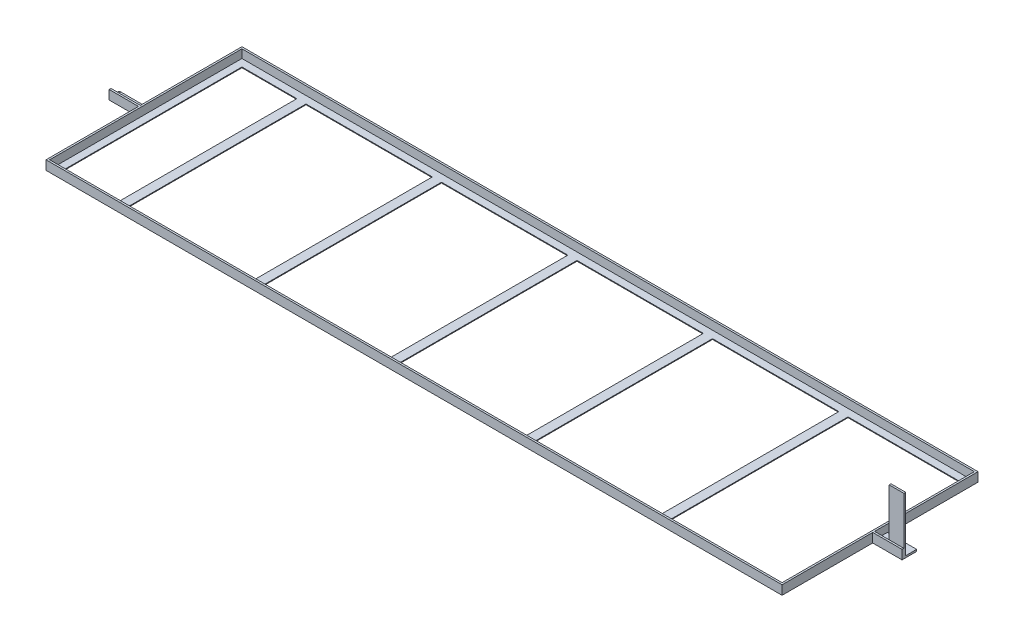
from build123d import *

# Parameters (mm, degrees)
SKETCH1_W           = 150
SKETCH1_H           = 485
SKETCH1_W_2         = 345
SKETCH1_W_3         = 305
BOSS_EXTRUDE1_DEPTH = 2
SKETCH2_W           = 2010
SKETCH2_H           = 535
SKETCH2_W_2         = 2000
SKETCH2_H_2         = 525
BOSS_EXTRUDE2_DEPTH = 25
BOSS_EXTRUDE3_DEPTH = 80
SKETCH4_W           = 40
SKETCH4_H           = 150
BOSS_EXTRUDE4_DEPTH = 5
BOSS_EXTRUDE5_DEPTH = 80
SKETCH8_R           = 2
BOSS_EXTRUDE7_DEPTH = 20


with BuildPart() as part:
    # Sketch1 → Boss-Extrude1 (new body)
    with BuildSketch(Plane(origin=(0, 0, 0), x_dir=(1, 0, 0), z_dir=(0, 1, 0))):
        Polygon((1000, -262.5), (1000, 242.5), (1000, 262.5), (-1000, 262.5), (-1000, -262.5), align=None)
        with Locations((-905, 0)):
            Rectangle(SKETCH1_W, SKETCH1_H, mode=Mode.SUBTRACT)
        with Locations((-632.5, 0)):
            Rectangle(SKETCH1_W_2, SKETCH1_H, mode=Mode.SUBTRACT)
        with Locations((-262.5, 0)):
            Rectangle(SKETCH1_W_2, SKETCH1_H, mode=Mode.SUBTRACT)
        with Locations((107.5, 0)):
            Rectangle(SKETCH1_W_2, SKETCH1_H, mode=Mode.SUBTRACT)
        with Locations((827.5, 0)):
            Rectangle(SKETCH1_W_3, SKETCH1_H, mode=Mode.SUBTRACT)
        with Locations((477.5, 0)):
            Rectangle(SKETCH1_W_2, SKETCH1_H, mode=Mode.SUBTRACT)
    extrude(amount=BOSS_EXTRUDE1_DEPTH)

    # Sketch2 → Boss-Extrude2 (add)
    with BuildSketch(Plane(origin=(0, 0, 0), x_dir=(1, 0, 0), z_dir=(0, 1, 0))):
        Rectangle(SKETCH2_W, SKETCH2_H)
        Rectangle(SKETCH2_W_2, SKETCH2_H_2, mode=Mode.SUBTRACT)
    extrude(amount=BOSS_EXTRUDE2_DEPTH)

    # Sketch3 → Boss-Extrude3 (add)
    with BuildSketch(Plane(origin=(1005, 0, 0), x_dir=(0, 0, -1), z_dir=(1, 0, 0))):
        Polygon((-20, 25), (-20, 0), (20, 0), (20, 5), (-15, 5), (-15, 25), align=None)
    extrude(amount=BOSS_EXTRUDE3_DEPTH)

    # Sketch4 → Boss-Extrude4 (add)
    with BuildSketch(Plane(origin=(0, 0, 15), x_dir=(-1, 0, 0), z_dir=(0, 0, -1))):
        with Locations((-1065, 80)):
            Rectangle(SKETCH4_W, SKETCH4_H)
    extrude(amount=BOSS_EXTRUDE4_DEPTH)

    # Sketch5 → Boss-Extrude5 (add)
    with BuildSketch(Plane.ZY.offset(1005)):
        Polygon((15, 25), (15, 0), (-15, 0), (-15, 5), (10, 5), (10, 25), align=None)
    extrude(amount=BOSS_EXTRUDE5_DEPTH)

    # Sketch8 → Boss-Extrude7 (add)
    with BuildSketch(Plane.XY.offset(15)):
        with Locations((-1077, 12.5)):
            Circle(SKETCH8_R)
    extrude(amount=-BOSS_EXTRUDE7_DEPTH)


solid = part.part
